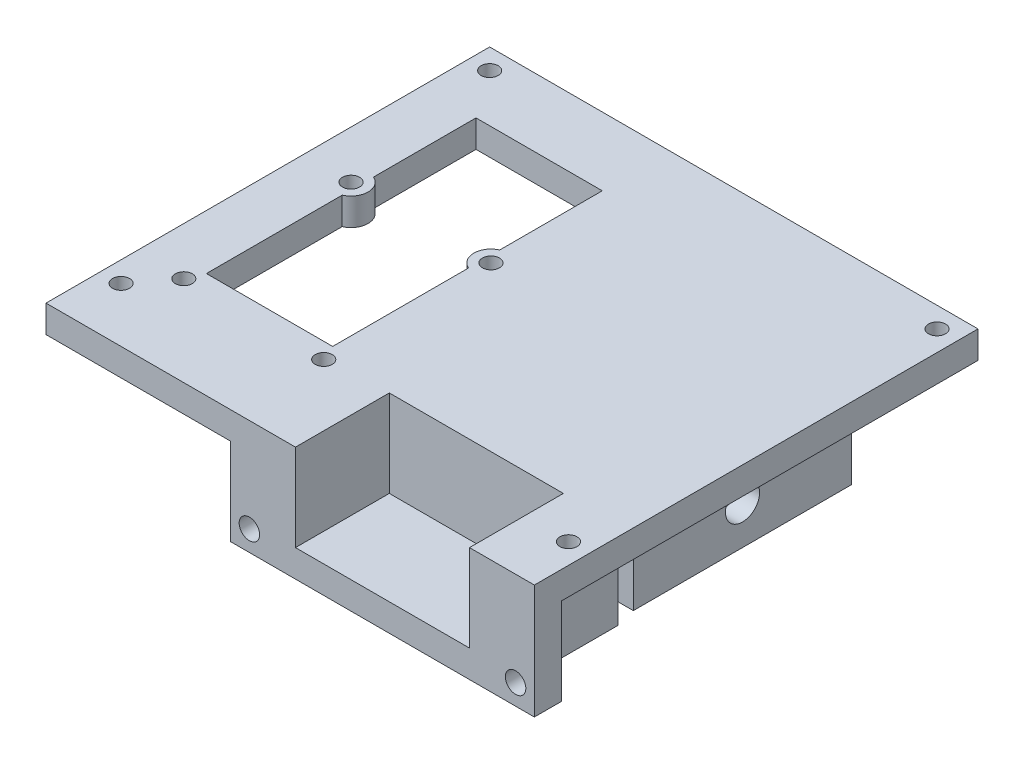
from build123d import *

# Parameters (mm, degrees)
BOSS_EXTRUDE1_DEPTH     = 4
BOSS_EXTRUDE2_DEPTH     = 8.75
SKETCH3_W               = 33.5
SKETCH3_H               = 17.75
BOSS_EXTRUDE3_DEPTH     = 4
SKETCH4_W               = 18.5
SKETCH4_H               = 39.5
CUT_EXTRUDE1_DEPTH      = 4
SKETCH5_W               = 5.5
SKETCH5_H               = 12.75
BOSS_EXTRUDE4_DEPTH     = 4
CUT_EXTRUDE2_DEPTH      = 98.503666598
CUT_EXTRUDE2_DEPTH_BACK = 98.503666598
SKETCH6_R               = 1.25
SKETCH7_R               = 2.5
SKETCH7_R_2             = 1.25
BOSS_EXTRUDE5_DEPTH     = 4
CUT_EXTRUDE3_DEPTH      = 99.106905975
CUT_EXTRUDE3_DEPTH_BACK = 99.106905975
SKETCH8_R               = 1.25
CUT_EXTRUDE4_DEPTH      = 95.88395544
CUT_EXTRUDE4_DEPTH_BACK = 95.88395544
SKETCH9_R               = 1.5
SKETCH11_W              = 32
SKETCH11_H              = 32
SKETCH11_W_2            = 26
SKETCH11_H_2            = 26
BOSS_EXTRUDE6_DEPTH     = 12.75
CUT_EXTRUDE6_DEPTH      = 94.014259659
CUT_EXTRUDE6_DEPTH_BACK = 94.014259659
CUT_EXTRUDE7_DEPTH      = 90.802714324
CUT_EXTRUDE7_DEPTH_BACK = 5


with BuildPart() as part:
    # Sketch1 → Boss-Extrude1 (new body)
    with BuildSketch(Plane(origin=(0, 0, 0), x_dir=(1, 0, 0), z_dir=(0, 1, 0))):
        Polygon((0, 0), (36.55, 0), (36.55, 13.75), (62.05, 13.75), (62.05, 0), (71.55, 0), (71.55, 65), (0, 65), align=None)
    extrude(amount=BOSS_EXTRUDE1_DEPTH)

    # Sketch2 → Boss-Extrude2 (add)
    with BuildSketch(Plane(origin=(0, 0, 0), x_dir=(1, 0, 0), z_dir=(0, 1, 0))):
        Polygon((62.05, 13.75), (62.05, 0), (66.05, 0), (66.05, 17.75), (32.55, 17.75), (32.55, 0), (36.55, 0), (36.55, 13.75), align=None)
    extrude(amount=-BOSS_EXTRUDE2_DEPTH)

    # Sketch3 → Boss-Extrude3 (add)
    with BuildSketch(Plane.XZ.offset(8.75)):
        with Locations((49.3, -8.875)):
            Rectangle(SKETCH3_W, SKETCH3_H)
    extrude(amount=BOSS_EXTRUDE3_DEPTH)

    # Sketch4 → Cut-Extrude1 (cut)
    with BuildSketch(Plane(origin=(0, 4, 0), x_dir=(1, 0, 0), z_dir=(0, 1, 0))):
        with Locations((17.25, 35.25)):
            Rectangle(SKETCH4_W, SKETCH4_H)
    extrude(amount=-CUT_EXTRUDE1_DEPTH, mode=Mode.SUBTRACT)

    # Sketch5 → Boss-Extrude4 (add)
    with BuildSketch(Plane.XY):
        with Locations((29.8, -6.375)):
            Rectangle(SKETCH5_W, SKETCH5_H)
        with Locations((68.8, -6.375)):
            Rectangle(SKETCH5_W, SKETCH5_H)
    extrude(amount=-BOSS_EXTRUDE4_DEPTH)

    # Sketch6 → Cut-Extrude2 (cut, two sides: drawn at the far end of the back side and taken through both)
    with BuildSketch(Plane.XZ.offset(-CUT_EXTRUDE2_DEPTH_BACK)):
        with Locations(Location((7, -13.19, 0), (0, 0, 270))):
            Circle(SKETCH6_R)
        with Locations(Location((27.5, -13.19, 0), (0, 0, 270))):
            Circle(SKETCH6_R)
        with BuildLine():
            ThreePointArc((26.5, -38.44), (27.895284708, -38.875854123), (28.75, -37.69))
            ThreePointArc((28.75, -37.69), (27.895284708, -36.504145877), (26.5, -36.94))
            Line((26.5, -36.94), (26.5, -38.44))
        make_face()
        with BuildLine():
            Line((26.5, -38.44), (26.5, -36.94))
            ThreePointArc((26.5, -36.94), (26.25, -37.69), (26.5, -38.44))
        make_face()
        with BuildLine():
            ThreePointArc((8, -38.44), (8.185854123, -38.085284708), (8.25, -37.69))
            ThreePointArc((8.25, -37.69), (8.185854123, -37.294715292), (8, -36.94))
            Line((8, -36.94), (8, -38.44))
        make_face()
        with BuildLine():
            Line((8, -38.44), (8, -36.94))
            ThreePointArc((8, -36.94), (5.75, -37.69), (8, -38.44))
        make_face()
    extrude(amount=CUT_EXTRUDE2_DEPTH + CUT_EXTRUDE2_DEPTH_BACK, mode=Mode.SUBTRACT)

    # Sketch7 → Boss-Extrude5 (add)
    # profile 1 of 2: a face of its own
    with BuildSketch(Plane.XZ):
        with Locations((7, -37.69)):
            Circle(SKETCH7_R)
        with Locations(Location((7, -37.69, 0), (0, 0, 270))):
            Circle(SKETCH7_R_2, mode=Mode.SUBTRACT)
    # profile 2 of 2: a face of its own
    with BuildSketch(Plane.XZ):
        with Locations((27.5, -37.69)):
            Circle(SKETCH7_R)
        with Locations(Location((27.5, -37.69, 0), (0, 0, 270))):
            Circle(SKETCH7_R_2, mode=Mode.SUBTRACT)
    extrude(amount=-BOSS_EXTRUDE5_DEPTH)

    # Sketch8 → Cut-Extrude3 (cut, two sides: drawn at the far end of the back side and taken through both)
    with BuildSketch(Plane(origin=(0, 4, 0), x_dir=(1, 0, 0), z_dir=(0, 1, 0)).offset(-CUT_EXTRUDE3_DEPTH_BACK)):
        with Locations(Location((3, 62, 0), (0, 0, 90))):
            Circle(SKETCH8_R)
        with Locations(Location((68.55, 62, 0), (0, 0, 90))):
            Circle(SKETCH8_R)
        with Locations(Location((68.55, 8, 0), (0, 0, 90))):
            Circle(SKETCH8_R)
        with Locations(Location((3, 8, 0), (0, 0, 90))):
            Circle(SKETCH8_R)
    extrude(amount=CUT_EXTRUDE3_DEPTH + CUT_EXTRUDE3_DEPTH_BACK, mode=Mode.SUBTRACT)

    # Sketch9 → Cut-Extrude4 (cut, two sides: drawn at the far end of the back side and taken through both)
    with BuildSketch(Plane(origin=(0, 0, -4), x_dir=(-1, 0, 0), z_dir=(0, 0, -1)).offset(-CUT_EXTRUDE4_DEPTH_BACK)):
        with Locations((-68.8, -9.75)):
            Circle(SKETCH9_R)
        with Locations((-29.8, -9.75)):
            Circle(SKETCH9_R)
    extrude(amount=CUT_EXTRUDE4_DEPTH + CUT_EXTRUDE4_DEPTH_BACK, mode=Mode.SUBTRACT)

    # Sketch11 → Boss-Extrude6 (add)
    with BuildSketch(Plane.XZ):
        with Locations((49.3, -36.75)):
            Rectangle(SKETCH11_W, SKETCH11_H)
        with Locations((49.3, -36.75)):
            Rectangle(SKETCH11_W_2, SKETCH11_H_2, mode=Mode.SUBTRACT)
    extrude(amount=BOSS_EXTRUDE6_DEPTH)

    # Sketch12 → Cut-Extrude6 (cut, two sides: drawn at the far end of the back side and taken through both)
    with BuildSketch(Plane(origin=(65.3, 0, 0), x_dir=(0, 0, -1), z_dir=(1, 0, 0)).offset(-CUT_EXTRUDE6_DEPTH_BACK)):
        with BuildLine():
            ThreePointArc((39.25, -7), (38.517766953, -5.232233047), (36.75, -4.5))
            Line((36.75, -4.5), (36.75, -9.5))
            ThreePointArc((36.75, -9.5), (38.517766953, -8.767766953), (39.25, -7))
        make_face()
        with BuildLine():
            Line((36.75, -9.5), (36.75, -4.5))
            ThreePointArc((36.75, -4.5), (34.25, -7), (36.75, -9.5))
        make_face()
    extrude(amount=CUT_EXTRUDE6_DEPTH + CUT_EXTRUDE6_DEPTH_BACK, mode=Mode.SUBTRACT)

    # Sketch13 → Cut-Extrude7 (cut, two sides: drawn at the far end of the back side and taken through both)
    with BuildSketch(Plane(origin=(0, 0, -52.75), x_dir=(-1, 0, 0), z_dir=(0, 0, -1)).offset(-CUT_EXTRUDE7_DEPTH_BACK)):
        with BuildLine():
            ThreePointArc((-46.8, -7), (-47.532233047, -5.232233047), (-49.3, -4.5))
            Line((-49.3, -4.5), (-49.3, -9.5))
            ThreePointArc((-49.3, -9.5), (-47.532233047, -8.767766953), (-46.8, -7))
        make_face()
        with BuildLine():
            Line((-49.3, -9.5), (-49.3, -4.5))
            ThreePointArc((-49.3, -4.5), (-51.8, -7), (-49.3, -9.5))
        make_face()
    extrude(amount=CUT_EXTRUDE7_DEPTH + CUT_EXTRUDE7_DEPTH_BACK, mode=Mode.SUBTRACT)


solid = part.part
